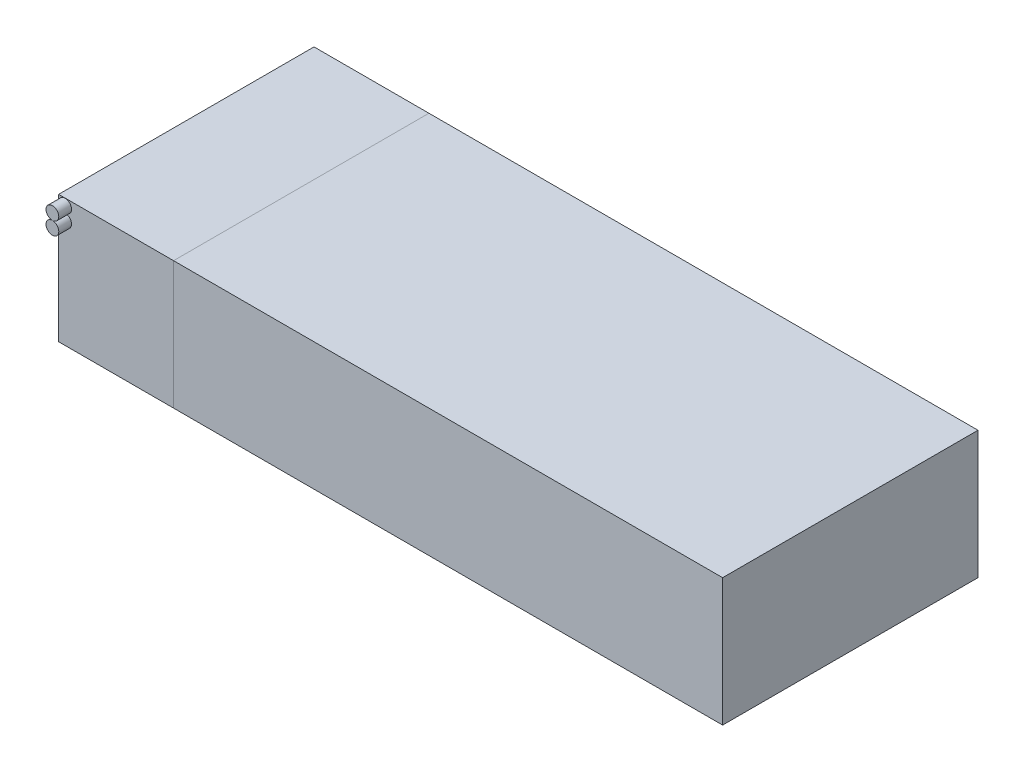
from build123d import *

# Parameters (mm, degrees)
SKETCH1_W           = 52
SKETCH1_H           = 20
BOSS_EXTRUDE1_DEPTH = 10
SKETCH3_R           = 0.5
BOSS_EXTRUDE7_DEPTH = 1


with BuildPart() as part:
    # Sketch1 → Boss-Extrude1 (new body)
    with BuildSketch(Plane(origin=(0, 0, 0), x_dir=(1, 0, 0), z_dir=(0, 1, 0))):
        with Locations((26, 10)):
            Rectangle(SKETCH1_W, SKETCH1_H)
    extrude(amount=BOSS_EXTRUDE1_DEPTH)

    # Sketch3 → Boss-Extrude7 (add)
    with BuildSketch(Plane.XY):
        with Locations(Location((0.51, 9.49, 0), (0, 0, 180))):
            Circle(SKETCH3_R)
        with Locations(Location((0.51, 8.48, 0), (0, 0, 180))):
            Circle(SKETCH3_R)
    extrude(amount=BOSS_EXTRUDE7_DEPTH)


solid = part.part
